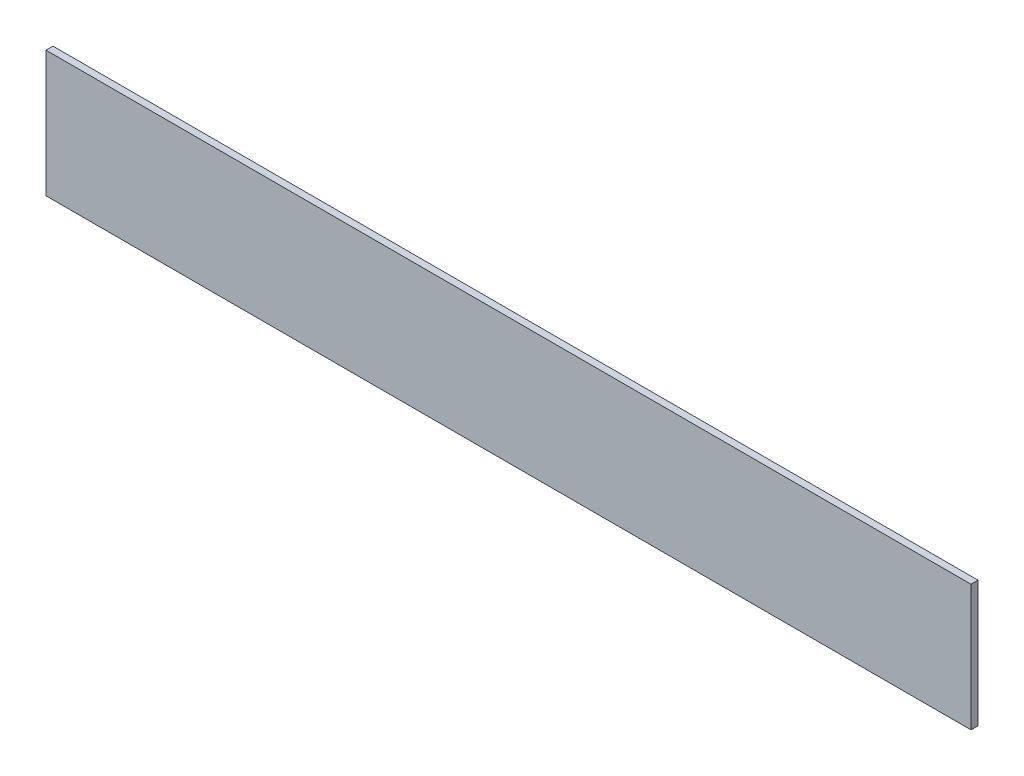
from build123d import *

# Parameters (mm, degrees)
PACK_KALIP_DUVARI_ARKA_1_START = -562.5
SKETCH1_W                      = 330
SKETCH1_H                      = 45
PACK_KALIP_DUVARI_ARKA_1_DEPTH = 2.5


with BuildPart() as part:
    # Sketch1 → PACK_kalip_duvari_arka_1 (new body)
    with BuildSketch(Plane.XY.offset(PACK_KALIP_DUVARI_ARKA_1_START)):
        with Locations((350, 574.5)):
            Rectangle(SKETCH1_W, SKETCH1_H)
    extrude(amount=-PACK_KALIP_DUVARI_ARKA_1_DEPTH)


solid = part.part
